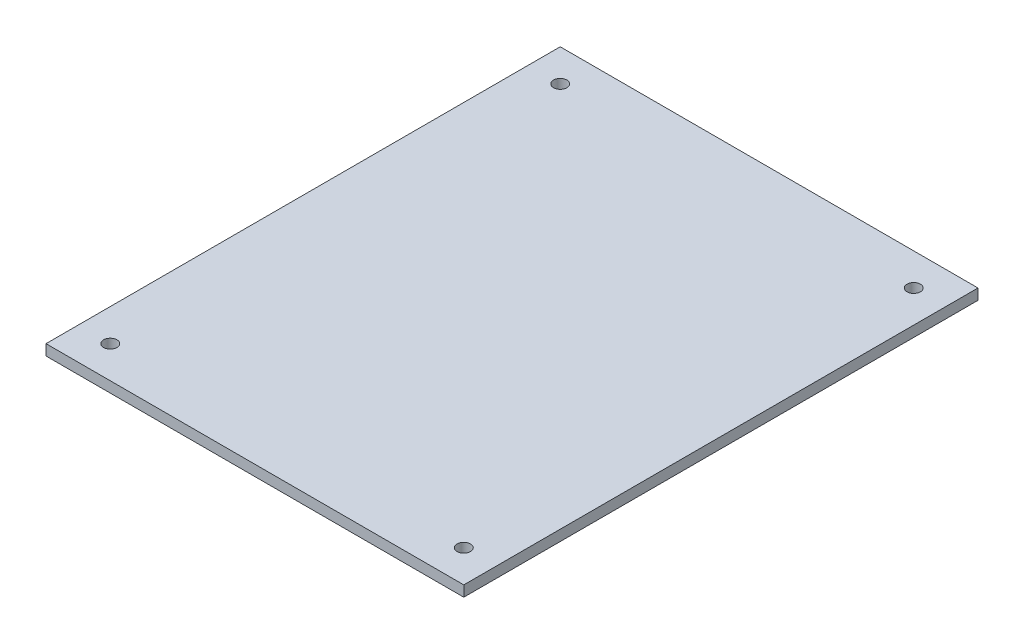
from build123d import *

# Parameters (mm, degrees)
SKETCH1_W           = 99.06
SKETCH1_H           = 121.92
SKETCH1_R           = 1.5875
BOSS_EXTRUDE1_DEPTH = 2.54


with BuildPart() as part:
    # Sketch1 → Boss-Extrude1 (new body)
    with BuildSketch(Plane(origin=(0, 0, 0), x_dir=(1, 0, 0), z_dir=(0, 1, 0))):
        with Locations((-7.699901001, 8.000399362)):
            Rectangle(SKETCH1_W, SKETCH1_H)
        with Locations(Location((-49.609901001, 61.340399362, 0), (0, 0, 270))):
            Circle(SKETCH1_R, mode=Mode.SUBTRACT)
        with Locations(Location((34.210098999, 61.340399362, 0), (0, 0, 270))):
            Circle(SKETCH1_R, mode=Mode.SUBTRACT)
        with Locations(Location((-49.609901001, -45.339600638, 0), (0, 0, 270))):
            Circle(SKETCH1_R, mode=Mode.SUBTRACT)
        with Locations(Location((34.210098999, -45.339600638, 0), (0, 0, 270))):
            Circle(SKETCH1_R, mode=Mode.SUBTRACT)
    extrude(amount=BOSS_EXTRUDE1_DEPTH)


solid = part.part
